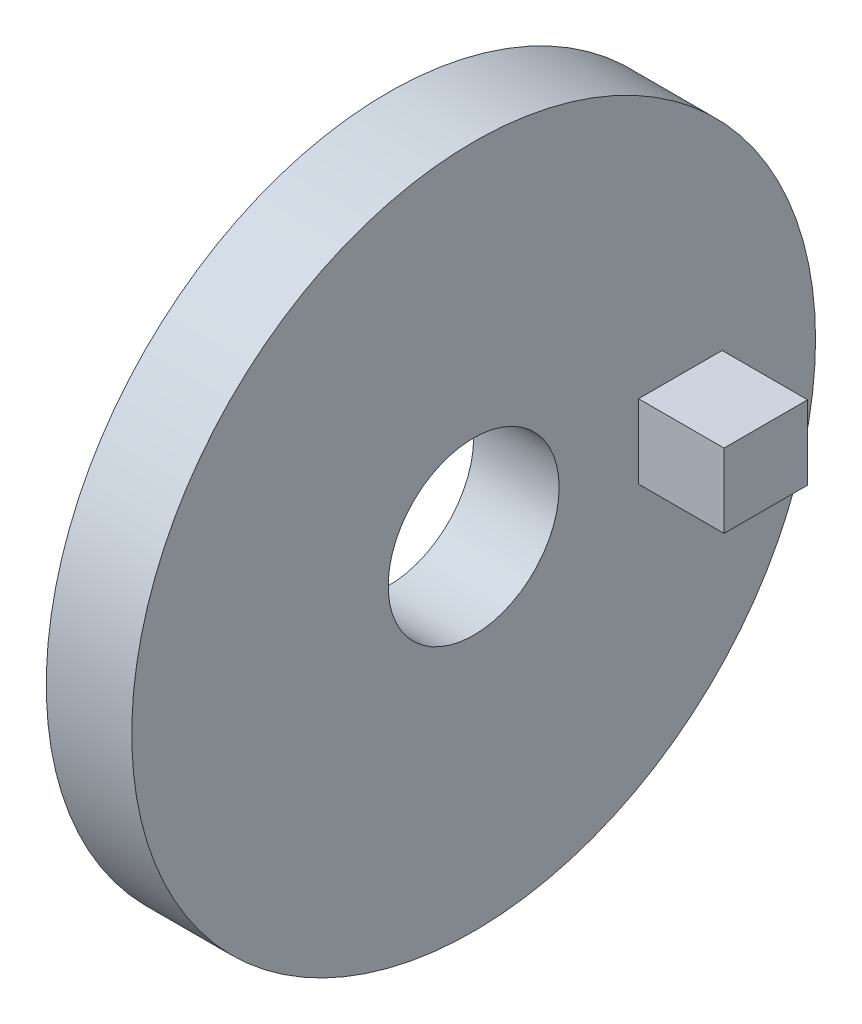
from build123d import *

# Parameters (mm, degrees)
SKETCH_1_R      = 40
SKETCH_1_R_2    = 10
EXTRUDE_1_DEPTH = 10
SKETCH_2_W      = 9.777839157
SKETCH_2_H      = 8.649626946
EXTRUDE_2_DEPTH = 10


with BuildPart() as part:
    # 草图1 → 凸台-拉伸1 (new body)
    with BuildSketch(Plane(origin=(0, 0, 0), x_dir=(0, 0, -1), z_dir=(1, 0, 0))):
        Circle(SKETCH_1_R)
        Circle(SKETCH_1_R_2, mode=Mode.SUBTRACT)
    extrude(amount=EXTRUDE_1_DEPTH)

    # 草图2 → 凸台-拉伸2 (add)
    with BuildSketch(Plane(origin=(10, 0, 0), x_dir=(0, 0, -1), z_dir=(1, 0, 0))):
        with Locations((24.181348377, 0)):
            Rectangle(SKETCH_2_W, SKETCH_2_H)
    extrude(amount=EXTRUDE_2_DEPTH)


solid = part.part
